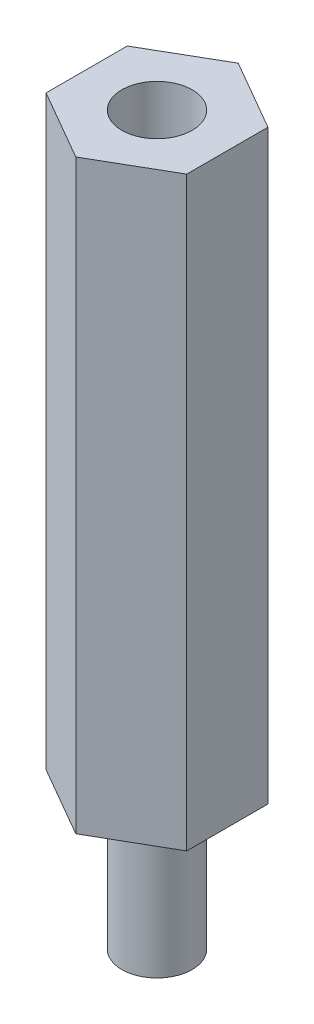
from build123d import *

# Parameters (mm, degrees)
BOSS_EXTRUDE1_DEPTH = 25
SKETCH2_R           = 1.5
BOSS_EXTRUDE2_DEPTH = 31
SKETCH3_R           = 1.5
CUT_EXTRUDE1_DEPTH  = 5


with BuildPart() as part:
    # Sketch1 → Boss-Extrude1 (new body)
    with BuildSketch(Plane(origin=(0, 0, 0), x_dir=(1, 0, 0), z_dir=(0, 1, 0))):
        Polygon((0, 3.464101615), (-3, 1.732050808), (-3, -1.732050808), (0, -3.464101615), (3, -1.732050808), (3, 1.732050808), align=None)
    extrude(amount=BOSS_EXTRUDE1_DEPTH)

    # Sketch2 → Boss-Extrude2 (add)
    with BuildSketch(Plane(origin=(0, 25, 0), x_dir=(1, 0, 0), z_dir=(0, 1, 0))):
        with Locations(Location((0, 0, 0), (0, 0, 270))):
            Circle(SKETCH2_R)
    extrude(amount=-BOSS_EXTRUDE2_DEPTH)

    # Sketch3 → Cut-Extrude1 (cut)
    with BuildSketch(Plane(origin=(0, 25, 0), x_dir=(1, 0, 0), z_dir=(0, 1, 0))):
        with Locations(Location((0, 0, 0), (0, 0, 270))):
            Circle(SKETCH3_R)
    extrude(amount=-CUT_EXTRUDE1_DEPTH, mode=Mode.SUBTRACT)


solid = part.part
